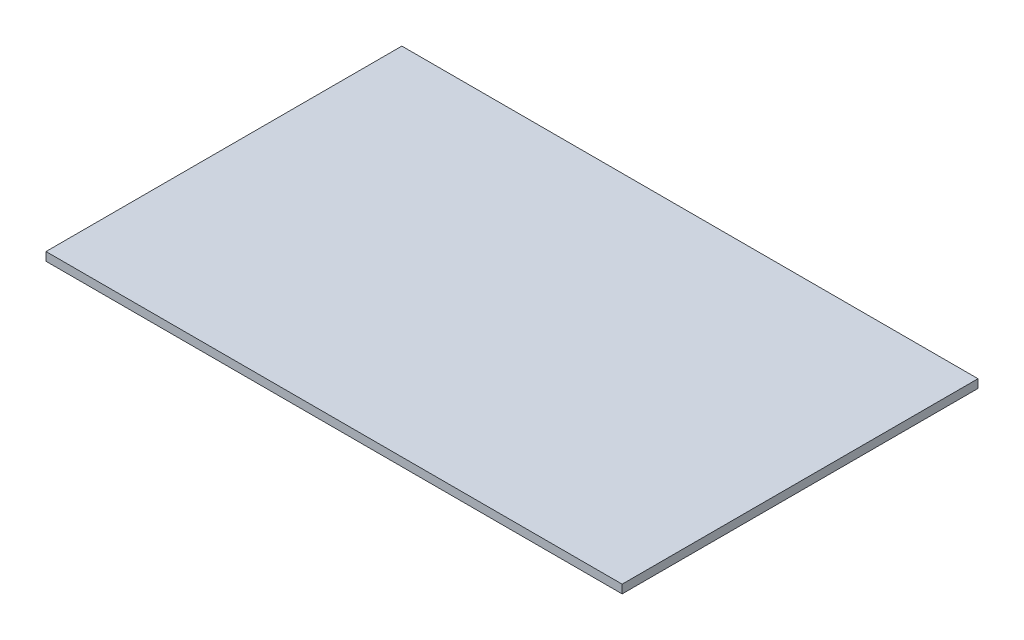
from build123d import *

# Parameters (mm, degrees)
SKETCH1_W           = 34
SKETCH1_H           = 21
BOSS_EXTRUDE1_DEPTH = 0.5


with BuildPart() as part:
    # Sketch1 → Boss-Extrude1 (new body)
    with BuildSketch(Plane(origin=(0, 0, 0), x_dir=(1, 0, 0), z_dir=(0, 1, 0))):
        with Locations((1.064007548, 2.930403585)):
            Rectangle(SKETCH1_W, SKETCH1_H)
    extrude(amount=BOSS_EXTRUDE1_DEPTH)


solid = part.part
